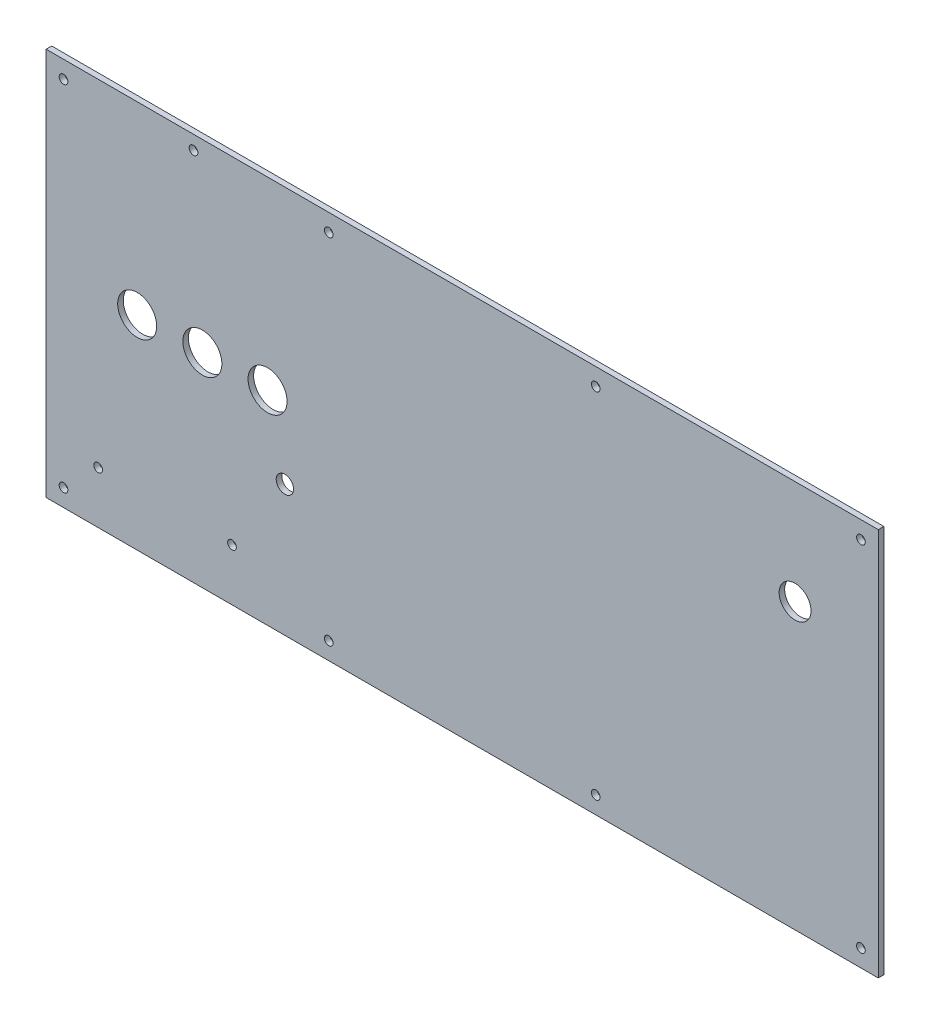
from build123d import *

# Parameters (mm, degrees)
SKETCH1_W          = 304.8
SKETCH1_H          = 142.24
EXTRUDE1_DEPTH     = 2.032
SKETCH3_R          = 1.5875
CUT_EXTRUDE1_DEPTH = 252.699806613
SKETCH4_R          = 7.14375
SKETCH4_R_2        = 1.5875
SKETCH4_R_3        = 3.175
SKETCH4_R_4        = 5.842
EXTRUDE2_DEPTH     = 252.699806613


with BuildPart() as part:
    # Sketch1 → Extrude1 (new body)
    with BuildSketch(Plane.XY):
        with Locations((55.245, 71.12)):
            Rectangle(SKETCH1_W, SKETCH1_H)
    extrude(amount=EXTRUDE1_DEPTH)

    # Sketch3 → Cut-Extrude1 (cut, through all)
    with BuildSketch(Plane.XY.offset(2.032)):
        with Locations((-90.805, 135.89)):
            Circle(SKETCH3_R)
        with Locations((-90.805, 6.35)):
            Circle(SKETCH3_R)
        with Locations((6.35, 135.89)):
            Circle(SKETCH3_R)
        with Locations((6.35, 6.35)):
            Circle(SKETCH3_R)
        with Locations(Location((104.14, 6.35, 0), (0, 0, 180))):
            Circle(SKETCH3_R)
        with Locations(Location((104.14, 135.89, 0), (0, 0, 180))):
            Circle(SKETCH3_R)
        with Locations(Location((201.295, 6.35, 0), (0, 0, 180))):
            Circle(SKETCH3_R)
        with Locations(Location((201.295, 135.89, 0), (0, 0, 180))):
            Circle(SKETCH3_R)
    extrude(amount=-CUT_EXTRUDE1_DEPTH, mode=Mode.SUBTRACT)

    # Sketch4 → Extrude2 (cut, through all)
    with BuildSketch(Plane.XY.offset(2.032)):
        with Locations((-63.8175, 74.6125)):
            Circle(SKETCH4_R)
        with Locations((-39.9415, 74.6125)):
            Circle(SKETCH4_R)
        with Locations((-16.0655, 74.6125)):
            Circle(SKETCH4_R)
        with Locations((-43.18, 137.16)):
            Circle(SKETCH4_R_2)
        with Locations((-9.7155, 47.9425)):
            Circle(SKETCH4_R_3)
        with Locations((-78.105, 19.05)):
            Circle(SKETCH4_R_2)
        with Locations((-29.083, 19.05)):
            Circle(SKETCH4_R_2)
        with Locations((177.165, 104.14)):
            Circle(SKETCH4_R_4)
    extrude(amount=-EXTRUDE2_DEPTH, mode=Mode.SUBTRACT)


solid = part.part
